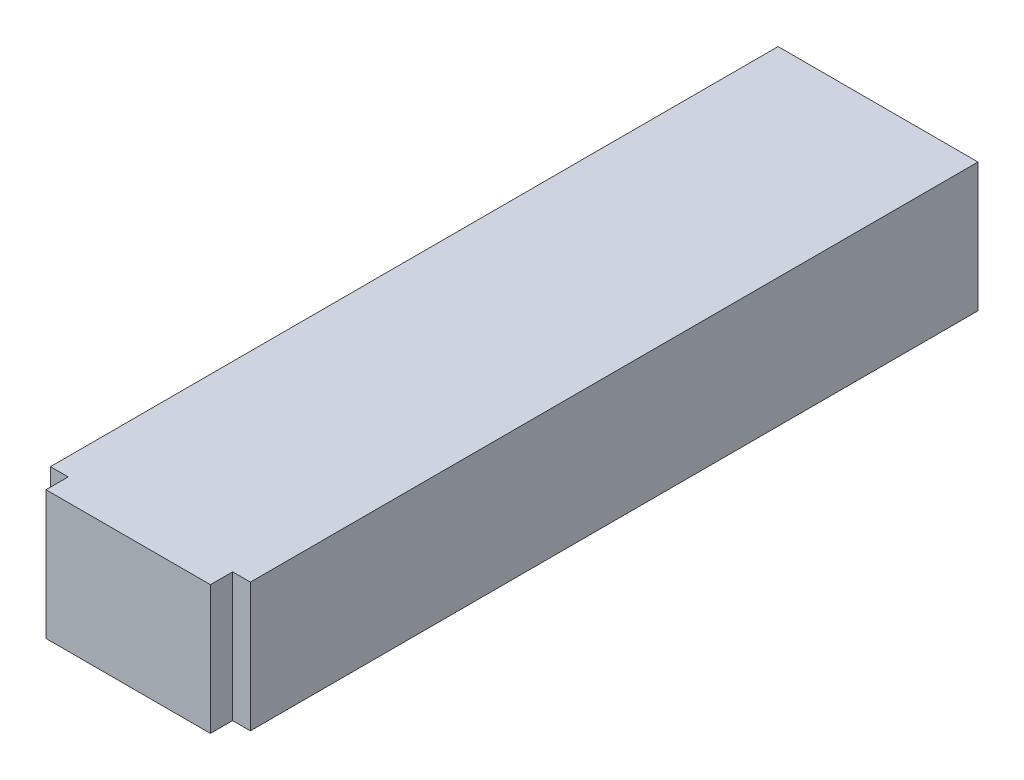
from build123d import *

# Parameters (mm, degrees)
EXTRUDE_1_DEPTH = 1160


with BuildPart() as part:
    # Эскиз1 → Бобышка-Вытянуть1 (new body)
    with BuildSketch(Plane(origin=(0, 0, 0), x_dir=(1, 0, 0), z_dir=(0, 1, 0))):
        Polygon((-740, -6150), (-740, -6350), (740, -6350), (740, -6150), (900, -6150), (900, 400), (-900, 400), (-900, -6150), align=None)
    extrude(amount=-EXTRUDE_1_DEPTH)


solid = part.part
